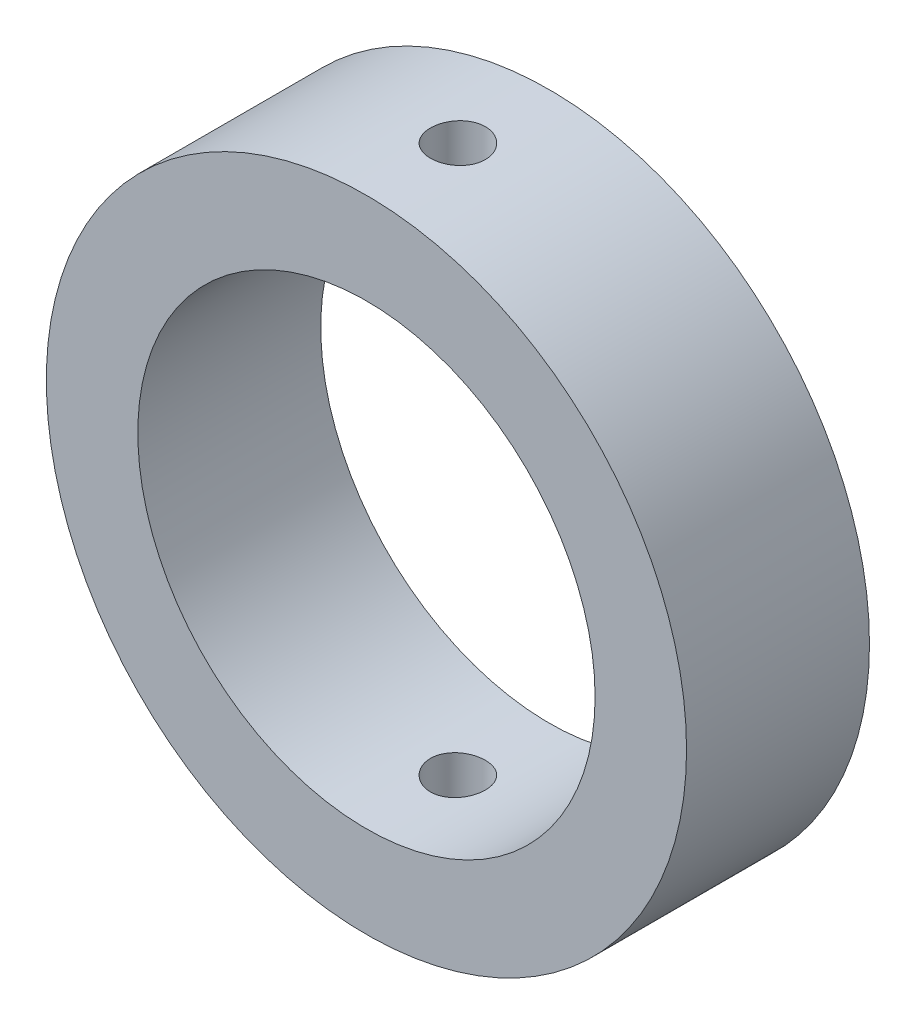
from build123d import *

# Parameters (mm, degrees)
SKETCH1_R               = 35
SKETCH1_R_2             = 25
BOSS_EXTRUDE2_DEPTH     = 10
CUT_EXTRUDE1_DEPTH      = 51.497524692
CUT_EXTRUDE1_DEPTH_BACK = 51.497524692
SKETCH2_R               = 3


with BuildPart() as part:
    # Sketch1 → Boss-Extrude2 (new, symmetric)
    with BuildSketch(Plane.XY):
        Circle(SKETCH1_R)
        Circle(SKETCH1_R_2, mode=Mode.SUBTRACT)
    extrude(amount=BOSS_EXTRUDE2_DEPTH, both=True)

    # Sketch2 → Cut-Extrude1 (cut, two sides: drawn at the far end of the back side and taken through both)
    with BuildSketch(Plane(origin=(0, 0, 0), x_dir=(1, 0, 0), z_dir=(0, 1, 0)).offset(-CUT_EXTRUDE1_DEPTH_BACK)):
        with Locations(Location((0, 0, 0), (0, 0, 270))):
            Circle(SKETCH2_R)
    extrude(amount=CUT_EXTRUDE1_DEPTH + CUT_EXTRUDE1_DEPTH_BACK, mode=Mode.SUBTRACT)


solid = part.part
